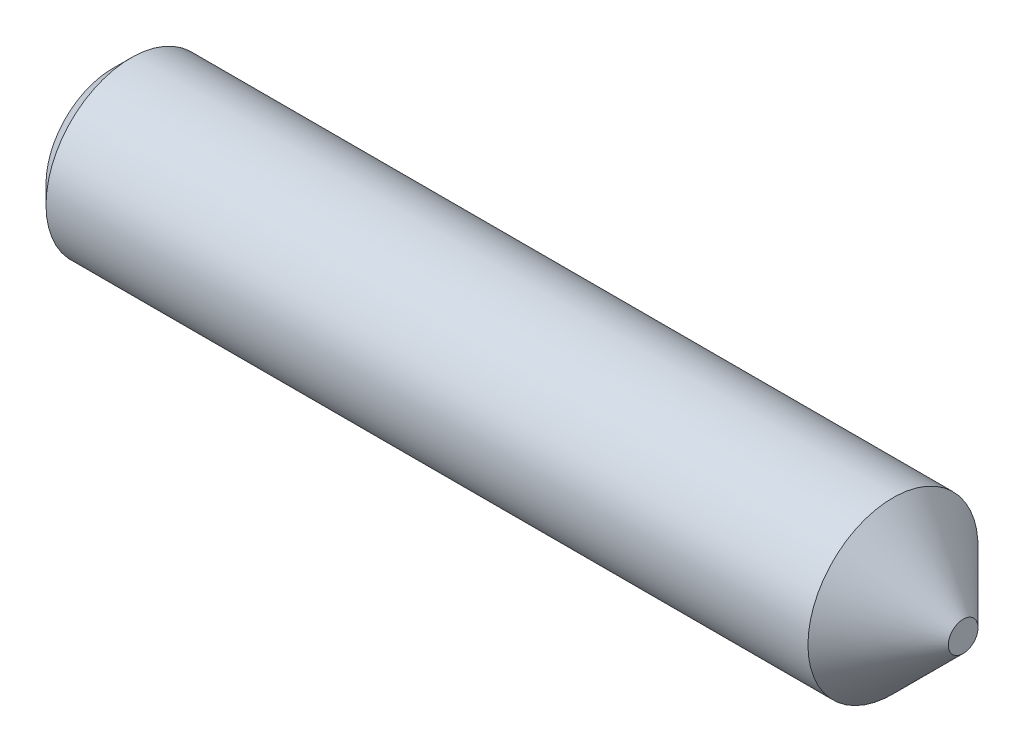
from build123d import *

# Parameters (mm, degrees)
CUT_EXTRUDE1_DEPTH = 3.166666667
CHAMFER1_SIZE      = 0.4295


with BuildPart() as part:
    # Sketch1 → Revolve1 (revolve)
    with BuildSketch(Plane.XY, mode=Mode.PRIVATE) as revolve1_sk:
        Polygon((0, 2), (0, 0), (20, 0), (20, 0.35), (18.35, 2), align=None)
    revolve(revolve1_sk.sketch.rotate(Axis((0, 0, 0), (1, 0, 0)), 270), axis=Axis((0, 0, 0), (1, 0, 0)))

    # Sketch2 → Cut-Extrude1 (cut)
    with BuildSketch(Plane.ZY):
        Polygon((0.577350269, 1), (-0.577350269, 1), (-1.154700538, 0), (-0.577350269, -1), (0.577350269, -1), (1.154700538, 0), align=None)
    extrude(amount=-CUT_EXTRUDE1_DEPTH, mode=Mode.SUBTRACT)

    # Chamfer1
    chamfer1_edges = [part.edges().sort_by_distance(p)[0] for p in [
        (0, 0, 2),
    ]]
    chamfer(chamfer1_edges, length=CHAMFER1_SIZE)


solid = part.part
